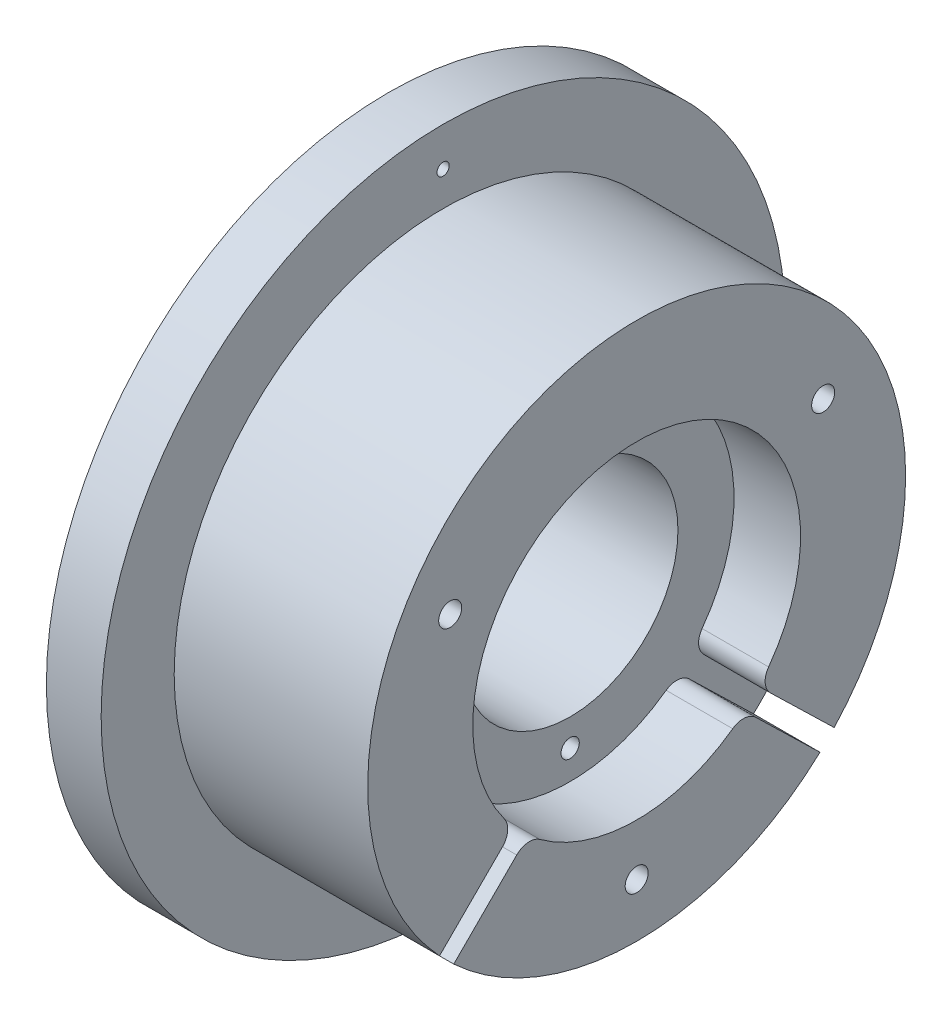
from build123d import *

# Parameters (mm, degrees)
SKETCH2_R                 = 0.315
CUT_EXTRUDE1_DEPTH        = 4.627
SKETCH3_R                 = 0.425
CUT_EXTRUDE2_DEPTH        = 37.233654202
SKETCH4_R                 = 0.635
CUT_EXTRUDE3_DEPTH        = 36.938117338
FILLET1_R                 = 1.25
M2X0_4_TAPPED_HOLE1_D     = 1.6
M2X0_4_TAPPED_HOLE1_DEPTH = 6.35
M2X0_4_TAPPED_HOLE1_TIP   = 0.480688495


with BuildPart() as part:
    # Sketch1 → Revolve1 (revolve)
    with BuildSketch(Plane.XY, mode=Mode.PRIVATE) as revolve1_sk:
        Polygon((0, 23.7871), (0, 7.5), (12.645, 7.5), (12.645, 11.4), (17.272, 11.4), (17.272, 18.7071), (3.81, 18.7071), (3.81, 23.7871), align=None)
    revolve(revolve1_sk.sketch.rotate(Axis((12.645, 0, 0), (-1, 0, 0)), 90), axis=Axis((12.645, 0, 0), (-1, 0, 0)))

    # Sketch2 → Cut-Extrude1 (cut)
    with BuildSketch(Plane(origin=(17.272, 0, 0), x_dir=(0, 0, -1), z_dir=(1, 0, 0))):
        with BuildLine():
            Line((-0.657808531, -0.677910665), (0, 0))
            Line((0, 0), (-0.494974747, 0.494974747))
            Line((-0.494974747, 0.494974747), (-8.540781108, -7.550831614))
            ThreePointArc((-8.540781108, -7.550831614), (-8.061017306, -8.061017306), (-7.550831614, -8.540781108))
            Line((-7.550831614, -8.540781108), (-0.16558691, -1.155536403))
            Line((-0.16558691, -1.155536403), (-0.657808531, -0.677910665))
        make_face()
        with BuildLine():
            Line((-12.723678558, -13.713628052), (-7.550831614, -8.540781108))
            ThreePointArc((-7.550831614, -8.540781108), (-8.061017306, -8.061017306), (-8.540781108, -7.550831614))
            Line((-8.540781108, -7.550831614), (-13.713628052, -12.723678558))
            ThreePointArc((-13.713628052, -12.723678558), (-13.473131789, -12.978070358), (-13.227917265, -13.227917267))
            ThreePointArc((-13.227917265, -13.227917267), (-12.978070357, -13.473131789), (-12.723678558, -13.713628052))
        make_face()
        with BuildLine():
            Line((13.738626304, -12.696682153), (8.492008215, -7.60564241))
            ThreePointArc((8.492008215, -7.60564241), (8.00885551, -8.112843732), (7.495463784, -8.589413406))
            Line((7.495463784, -8.589413406), (12.750537979, -13.688658505))
            ThreePointArc((12.750537979, -13.688658505), (13.09218126, -13.362274517), (13.425472665, -13.027366354))
            ThreePointArc((13.425472665, -13.027366354), (13.58305585, -12.862977268), (13.738626304, -12.696682153))
        make_face()
        with BuildLine():
            Line((8.492008215, -7.60564241), (0.317132147, 0.326823466))
            Line((0.317132147, 0.326823466), (0, 0))
            Line((0, 0), (0.494974747, -0.494974747))
            Line((0.494974747, -0.494974747), (-0.16558691, -1.155536403))
            Line((-0.16558691, -1.155536403), (7.495463784, -8.589413406))
            ThreePointArc((7.495463784, -8.589413406), (8.00885551, -8.112843732), (8.492008215, -7.60564241))
        make_face()
        with Locations((0, -14.9775)):
            Circle(SKETCH2_R)
        with Locations((-12.970895485, 7.48875)):
            Circle(SKETCH2_R)
        with Locations((12.970895485, 7.48875)):
            Circle(SKETCH2_R)
    extrude(amount=-CUT_EXTRUDE1_DEPTH, mode=Mode.SUBTRACT)

    # Sketch3 → Cut-Extrude2 (cut, through all)
    with BuildSketch(Plane(origin=(3.81, 0, 0), x_dir=(0, 0, -1), z_dir=(1, 0, 0))):
        with Locations(Location((0, 21.082, 0), (0, 0, 90))):
            Circle(SKETCH3_R)
    extrude(amount=-CUT_EXTRUDE2_DEPTH, mode=Mode.SUBTRACT)

    # Sketch4 → Cut-Extrude3 (cut, through all)
    with BuildSketch(Plane(origin=(12.645, 0, 0), x_dir=(0, 0, -1), z_dir=(1, 0, 0))):
        with Locations(Location((0, 9.375, 0), (0, 0, 90))):
            Circle(SKETCH4_R)
        with Locations(Location((0, -9.375, 0), (0, 0, 90))):
            Circle(SKETCH4_R)
    extrude(amount=-CUT_EXTRUDE3_DEPTH, mode=Mode.SUBTRACT)

    # Fillet1
    fillet1_edges = [part.edges().sort_by_distance(p)[0] for p in [
        (14.9585, -7.550831614, 8.540781108),
        (14.9585, -8.540781108, 7.550831614),
        (14.9585, -7.60564241, -8.492008215),
        (14.9585, -8.589413406, -7.495463784),
    ]]
    fillet(fillet1_edges, radius=FILLET1_R)

    # M2x0.4 Tapped Hole1
    with Locations(Plane(origin=(17.272, 7.48875, 12.970895485), x_dir=(0, 0, 1), z_dir=(1, 0, 0))):
        with Locations((0, 0), (-25.94179097, 0), (-12.970895485, 22.46625)):
            Hole(M2X0_4_TAPPED_HOLE1_D / 2, depth=M2X0_4_TAPPED_HOLE1_DEPTH)
            with Locations((0, 0, -(M2X0_4_TAPPED_HOLE1_DEPTH + M2X0_4_TAPPED_HOLE1_TIP / 2))):  # 118° drill point
                Cone(0, M2X0_4_TAPPED_HOLE1_D / 2, M2X0_4_TAPPED_HOLE1_TIP, mode=Mode.SUBTRACT)


solid = part.part
